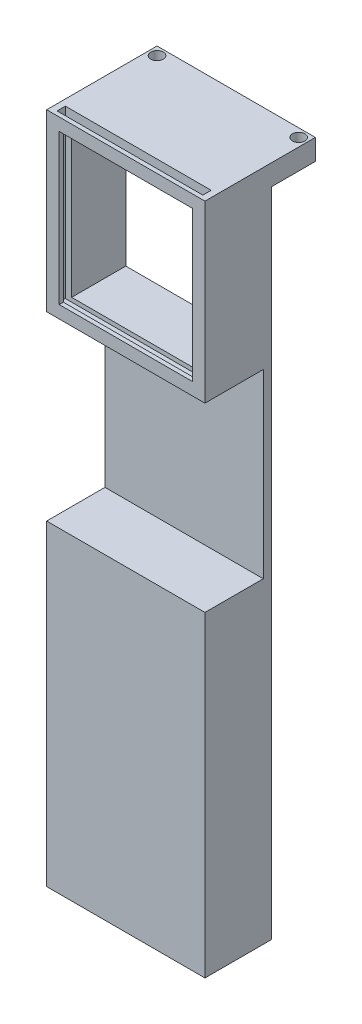
from build123d import *

# Parameters (mm, degrees)
P_IDAT_VYSUNUT_M1_DEPTH   = 12
SKICA2_R                  = 1.75
P_IDAT_VYSUNUT_M1_2_DEPTH = 12
SKICA3_W                  = 38
SKICA3_H                  = 43.5
P_IDAT_VYSUNUT_M2_DEPTH   = 2
P_IDAT_VYSUNUT_M3_DEPTH   = 10.5
SKICA5_W                  = 38
SKICA5_H                  = 5
P_IDAT_VYSUNUT_M4_DEPTH   = 4
SKICA7_W                  = 38
SKICA7_H                  = 76
P_IDAT_VYSUNUT_M5_DEPTH   = 4
SKICA8_W                  = 38
SKICA8_H                  = 42
SKICA8_W_2                = 32
SKICA8_H_2                = 36
P_IDAT_VYSUNUT_M6_DEPTH   = 4
SKICA9_W                  = 35
SKICA9_H                  = 2
ODEBRAT_VYSUNUT_M2_DEPTH  = 40
ODEBRAT_START             = -5
SKICA11_R                 = 1.5
ODEBRAT_VYSUNUT_M3_DEPTH  = 5
P_IDAT_START              = -12
SKICA13_R                 = 1.75
P_IDAT_VYSUNUT_M7_DEPTH   = 12


with BuildPart() as part:
    # Skica2 → Přidat vysunutím1 (new body)
    with BuildSketch(Plane.XY):
        Polygon((36, 151.5), (36, 114.5), (33, 114.5), (1, 114.5), (-2, 114.5), (-2, 151.5), (-2, 156.5), (36, 156.5), align=None)
        Polygon((33, 151.5), (33, 117.5), (1, 117.5), (1, 151.5), (1, 153.5), (33, 153.5), align=None, mode=Mode.SUBTRACT)
    extrude(amount=P_IDAT_VYSUNUT_M1_DEPTH)



with BuildPart() as body_2:
    # Skica2 → P_idat vysunut_m1 2 (new body)
    with BuildSketch(Plane.XY):
        Polygon((36, -5), (33, -5), (1, -5), (-2, -5), (-2, 71), (1, 71), (33, 71), (36, 71), align=None)
        with Locations((0, -3)):
            Circle(SKICA2_R, mode=Mode.SUBTRACT)
        with Locations((34, -3)):
            Circle(SKICA2_R, mode=Mode.SUBTRACT)
        with BuildLine():
            Line((1, 68), (33, 68))
            Line((33, 68), (33, -1.267949192))
            ThreePointArc((33, -1.267949192), (32.585786438, -1.585786438), (32.267949192, -2))
            Line((32.267949192, -2), (1.732050808, -2))
            ThreePointArc((1.732050808, -2), (1.414213562, -1.585786438), (1, -1.267949192))
            Line((1, -1.267949192), (1, 68))
        make_face(mode=Mode.SUBTRACT)
    extrude(amount=P_IDAT_VYSUNUT_M1_2_DEPTH)


with BuildPart() as part_1:
    add(part.part)

    add(body_2.part)  # Přidat vysunutím2 merges body 2
    # Skica3 → Přidat vysunutím2 (add)
    with BuildSketch(Plane.XY):
        with Locations((17, 92.75)):
            Rectangle(SKICA3_W, SKICA3_H)
    extrude(amount=P_IDAT_VYSUNUT_M2_DEPTH)

    # Skica4 → Přidat vysunutím3 (add)
    with BuildSketch(Plane(origin=(0, 0, 0), x_dir=(-1, 0, 0), z_dir=(0, 0, -1))):
        Polygon((-36, 156.5), (2, 156.5), (2, 154.5), (2, 151.5), (-1, 151.5), (-1, 153.5), (-33, 153.5), (-33, 151.5), (-36, 151.5), (-36, 154.5), align=None)
    extrude(amount=P_IDAT_VYSUNUT_M3_DEPTH)

    # Skica5 → Přidat vysunutím4 (add)
    with BuildSketch(Plane(origin=(0, 0, -10.5), x_dir=(-1, 0, 0), z_dir=(0, 0, -1))):
        with Locations((-17, 154)):
            Rectangle(SKICA5_W, SKICA5_H)
    extrude(amount=-P_IDAT_VYSUNUT_M4_DEPTH)

    # Skica7 → Přidat vysunutím5 (add)
    with BuildSketch(Plane.XY.offset(12)):
        with Locations((17, 33)):
            Rectangle(SKICA7_W, SKICA7_H)
    extrude(amount=P_IDAT_VYSUNUT_M5_DEPTH)

    # Skica8 → Přidat vysunutím6 (add)
    with BuildSketch(Plane.XY.offset(12)):
        with Locations((17, 135.5)):
            Rectangle(SKICA8_W, SKICA8_H)
        with Locations((17, 135.5)):
            Rectangle(SKICA8_W_2, SKICA8_H_2, mode=Mode.SUBTRACT)
    extrude(amount=P_IDAT_VYSUNUT_M6_DEPTH)

    # Skica9 → Odebrat vysunutím2 (cut)
    with BuildSketch(Plane(origin=(0, 156.5, 0), x_dir=(1, 0, 0), z_dir=(0, 1, 0))):
        with Locations((17, -14)):
            Rectangle(SKICA9_W, SKICA9_H)
    extrude(amount=-ODEBRAT_VYSUNUT_M2_DEPTH, mode=Mode.SUBTRACT)

    # Skica11 → Odebrat vysunutím3 (cut)
    with BuildSketch(Plane(origin=(0, 156.5, 0), x_dir=(1, 0, 0), z_dir=(0, 1, 0)).offset(ODEBRAT_START)):
        with Locations(Location((0, 8.5, 0), (0, 0, 270))):
            Circle(SKICA11_R)
        with Locations(Location((34, 8.5, 0), (0, 0, 270))):
            Circle(SKICA11_R)
    extrude(amount=ODEBRAT_VYSUNUT_M3_DEPTH, mode=Mode.SUBTRACT)

    # Skica13 → Přidat vysunutím7 (add)
    with BuildSketch(Plane.XY.offset(16).offset(P_IDAT_START)):
        with Locations((0, -3)):
            Circle(SKICA13_R)
        with Locations((34, -3)):
            Circle(SKICA13_R)
    extrude(amount=P_IDAT_VYSUNUT_M7_DEPTH)


solid = part_1.part
